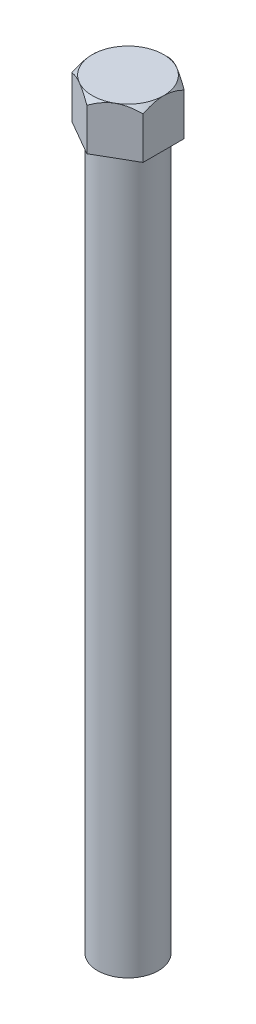
from build123d import *

# Parameters (mm, degrees)
BOSS_EXTRUDE1_DEPTH = 0.2
SKETCH2_R           = 0.128248653
BOSS_EXTRUDE2_DEPTH = 3
SKETCH7_OUTSIDE_W   = 3.006
SKETCH7_OUTSIDE_H   = 3.052
SKETCH7_OUTSIDE_R   = 0.15
CUT_EXTRUDE2_DEPTH  = 0.03
CUT_EXTRUDE2_DRAFT  = -45


with BuildPart() as part:
    # Sketch1 → Boss-Extrude1 (new body)
    with BuildSketch(Plane(origin=(0, 0, 0), x_dir=(1, 0, 0), z_dir=(0, 1, 0))):
        Polygon((0.15, 0.08660254), (0, 0.173205081), (-0.15, 0.08660254), (-0.15, -0.08660254), (0, -0.173205081), (0.15, -0.08660254), align=None)
    extrude(amount=BOSS_EXTRUDE1_DEPTH)

    # Sketch2 → Boss-Extrude2 (add)
    with BuildSketch(Plane.XZ):
        with Locations(Location((0, 0, 0), (0, 0, 270))):
            Circle(SKETCH2_R)
    extrude(amount=BOSS_EXTRUDE2_DEPTH)


with BuildPart() as cut_extrude2_tool:
    # Sketch7 outside → Cut-Extrude2 (with draft: the straight prism first)
    with BuildSketch(Plane(origin=(0, 0.2, 0), x_dir=(1, 0, 0), z_dir=(0, 1, 0))):
        Rectangle(SKETCH7_OUTSIDE_W, SKETCH7_OUTSIDE_H)
        Circle(SKETCH7_OUTSIDE_R, mode=Mode.SUBTRACT)
    extrude(amount=-CUT_EXTRUDE2_DEPTH)
    # Cut-Extrude2: the draft: its side faces are tilted about the plane it starts from
    cut_extrude2_sides = [cut_extrude2_tool.faces().sort_by_distance(p)[0] for p in [
        (0, 0.185, 1.526),
        (1.503, 0.185, 0),
        (0, 0.185, -1.526),
        (-1.503, 0.185, 0),
        (-0.15, 0.185, 0),
    ]]
    draft(cut_extrude2_sides, Plane(origin=(0, 0.2, 0), x_dir=(1, 0, 0), z_dir=(0, 1, 0)), CUT_EXTRUDE2_DRAFT)


with BuildPart() as part_1:
    add(part.part)

    # Cut-Extrude2: cut by cut_extrude2_tool
    add(cut_extrude2_tool.part, mode=Mode.SUBTRACT)


solid = part_1.part
